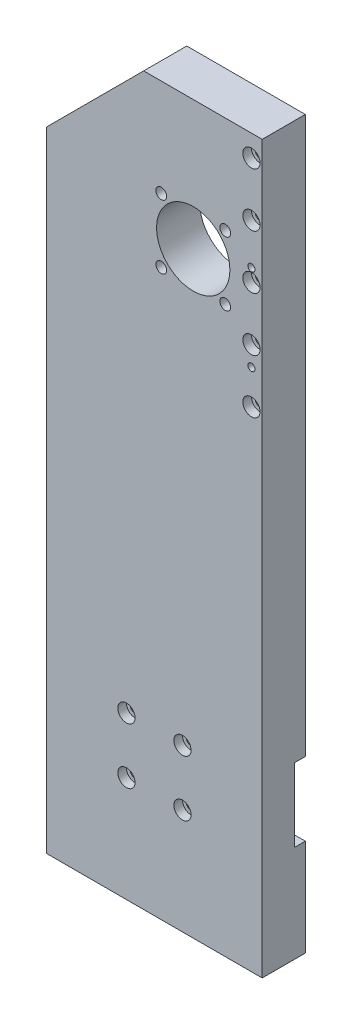
from build123d import *

# Parameters (mm, degrees)
SKETCH1_W                      = 100
SKETCH1_H                      = 337
SKETCH1_R                      = 17
SKETCH1_R_2                    = 2.5
SKETCH1_R_3                    = 2
BOSS_EXTRUDE1_DEPTH            = 20
CHAMFER1_SIZE                  = 45
SKETCH2_W                      = 100
SKETCH2_H                      = 34
CUT_EXTRUDE1_DEPTH             = 5
CBORE_FOR_M4_SHCS1_D           = 4.5
CBORE_FOR_M4_SHCS1_CBORE_D     = 8
CBORE_FOR_M4_SHCS1_CBORE_DEPTH = 4
CBORE_FOR_M4_SHCS2_D           = 4.5
CBORE_FOR_M4_SHCS2_CBORE_D     = 8
CBORE_FOR_M4_SHCS2_CBORE_DEPTH = 4
M4_TAPPED_HOLE1_D              = 3.3
M4_TAPPED_HOLE1_DEPTH          = 16.1
M4_TAPPED_HOLE1_TIP            = 0.991420021
M4_TAPPED_HOLE2_D              = 3.3


with BuildPart() as part:
    # Sketch1 → Boss-Extrude1 (new body)
    with BuildSketch(Plane.XY):
        with Locations((47.704546062, 452.000370419)):
            Rectangle(SKETCH1_W, SKETCH1_H)
        with Locations((65.704546062, 560.500370419)):
            Circle(SKETCH1_R, mode=Mode.SUBTRACT)
        with Locations((80.553788467, 575.349612824)):
            Circle(SKETCH1_R_2, mode=Mode.SUBTRACT)
        with Locations((80.553788467, 545.651128014)):
            Circle(SKETCH1_R_2, mode=Mode.SUBTRACT)
        with Locations((50.855303657, 545.651128014)):
            Circle(SKETCH1_R_2, mode=Mode.SUBTRACT)
        with Locations((50.855303657, 575.349612824)):
            Circle(SKETCH1_R_2, mode=Mode.SUBTRACT)
        with Locations((34.704546062, 358.500370419)):
            Circle(SKETCH1_R_3, mode=Mode.SUBTRACT)
        with Locations((60.704546062, 358.500370419)):
            Circle(SKETCH1_R_3, mode=Mode.SUBTRACT)
        with Locations((34.704546062, 332.500370419)):
            Circle(SKETCH1_R_3, mode=Mode.SUBTRACT)
        with Locations((60.704546062, 332.500370419)):
            Circle(SKETCH1_R_3, mode=Mode.SUBTRACT)
    extrude(amount=BOSS_EXTRUDE1_DEPTH)

    # Chamfer1
    chamfer1_edges = [part.edges().sort_by_distance(p)[0] for p in [
        (-2.295453938, 620.500370419, 10),
    ]]
    chamfer(chamfer1_edges, length=CHAMFER1_SIZE)

    # Sketch2 → Cut-Extrude1 (cut)
    with BuildSketch(Plane.XY):
        with Locations((47.704546062, 345.500370419)):
            Rectangle(SKETCH2_W, SKETCH2_H)
    extrude(amount=CUT_EXTRUDE1_DEPTH, mode=Mode.SUBTRACT)

    # CBORE for M4 SHCS1 (through all)
    with Locations(Plane.XY.offset(20)):
        with Locations((92.704546062, 610.500370419), (92.704546062, 585.500370419), (92.704546062, 560.500370419), (92.704546062, 535.500370419), (92.704546062, 510.500370419)):
            CounterBoreHole(CBORE_FOR_M4_SHCS1_D / 2, CBORE_FOR_M4_SHCS1_CBORE_D / 2, CBORE_FOR_M4_SHCS1_CBORE_DEPTH)

    # CBORE for M4 SHCS2 (through all)
    with Locations(Plane(origin=(34.704546062, 358.500370419, 20), x_dir=(1, 0, 0), z_dir=(0, 0, 1))):
        with Locations((0, 0), (26, 0), (0, -26), (26, -26)):
            CounterBoreHole(CBORE_FOR_M4_SHCS2_D / 2, CBORE_FOR_M4_SHCS2_CBORE_D / 2, CBORE_FOR_M4_SHCS2_CBORE_DEPTH)

    # M4 Tapped Hole1
    with Locations(Plane(origin=(7.704546062, 283.500370419, 10), x_dir=(0, 0, -1), z_dir=(0, -1, 0))):
        with Locations((0, 0), (0, 20), (0, 60), (0, 80)):
            Hole(M4_TAPPED_HOLE1_D / 2, depth=M4_TAPPED_HOLE1_DEPTH)
            with Locations((0, 0, -(M4_TAPPED_HOLE1_DEPTH + M4_TAPPED_HOLE1_TIP / 2))):  # 118° drill point
                Cone(0, M4_TAPPED_HOLE1_D / 2, M4_TAPPED_HOLE1_TIP, mode=Mode.SUBTRACT)

    # M4 Tapped Hole2 (through all)
    with Locations(Plane.XY.offset(20)):
        with Locations((92.704546062, 566.40602011), (92.704546062, 526.40602011)):
            Hole(M4_TAPPED_HOLE2_D / 2)


solid = part.part
